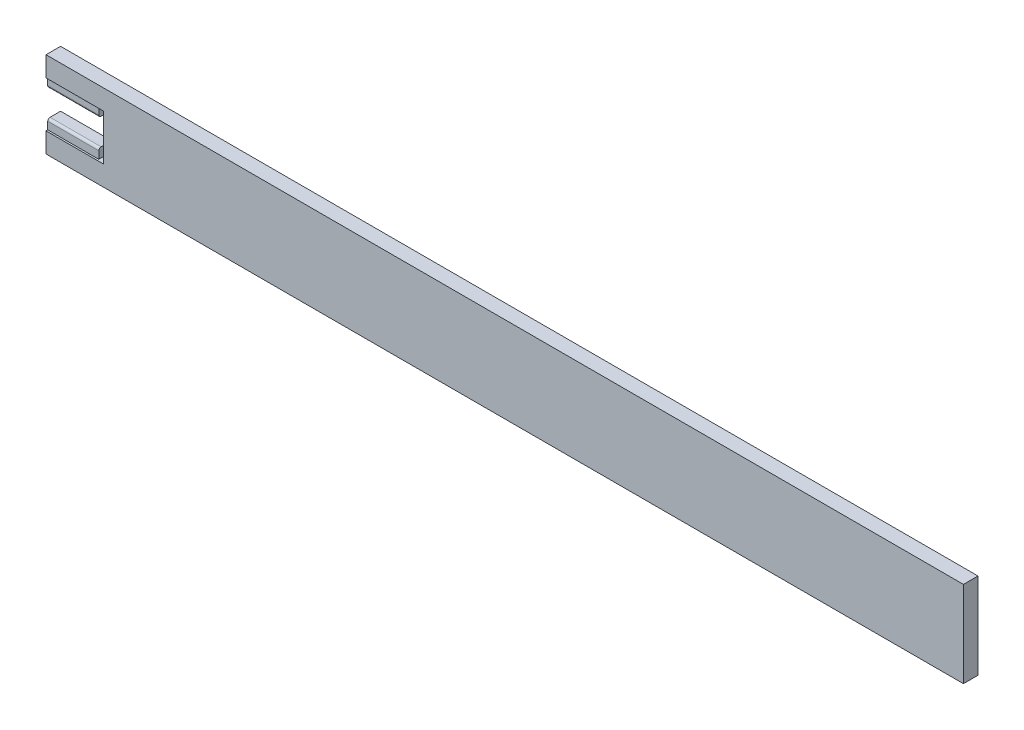
from build123d import *

# Parameters (mm, degrees)
SKETCH1_W           = 1600
SKETCH1_H           = 150
BOSS_EXTRUDE1_DEPTH = 25.4
CUT_EXTRUDE1_DEPTH  = 1608.216587769
SKETCH3_W           = 100
SKETCH3_H           = 80
CUT_EXTRUDE2_DEPTH  = 3
FILLET1_R           = 4


with BuildPart() as part:
    # Sketch1 → Boss-Extrude1 (new body)
    with BuildSketch(Plane.XY):
        with Locations((800, 75)):
            Rectangle(SKETCH1_W, SKETCH1_H)
    extrude(amount=BOSS_EXTRUDE1_DEPTH)

    # Sketch2 → Cut-Extrude1 (cut, through all)
    with BuildSketch(Plane.XY.offset(25.4)):
        Polygon((0, 52), (89, 52), (89, 35), (100, 35), (100, 115), (89, 115), (89, 98), (0, 98), align=None)
    extrude(amount=-CUT_EXTRUDE1_DEPTH, mode=Mode.SUBTRACT)

    # Sketch3 → Cut-Extrude2 (cut)
    with BuildSketch(Plane.XY.offset(25.4)):
        with Locations((50, 75)):
            Rectangle(SKETCH3_W, SKETCH3_H)
    extrude(amount=-CUT_EXTRUDE2_DEPTH, mode=Mode.SUBTRACT)

    # Fillet1
    fillet1_edges = [part.edges().sort_by_distance(p)[0] for p in [
        (44.5, 52, 22.4),
        (44.5, 98, 22.4),
    ]]
    fillet(fillet1_edges, radius=FILLET1_R)


solid = part.part
